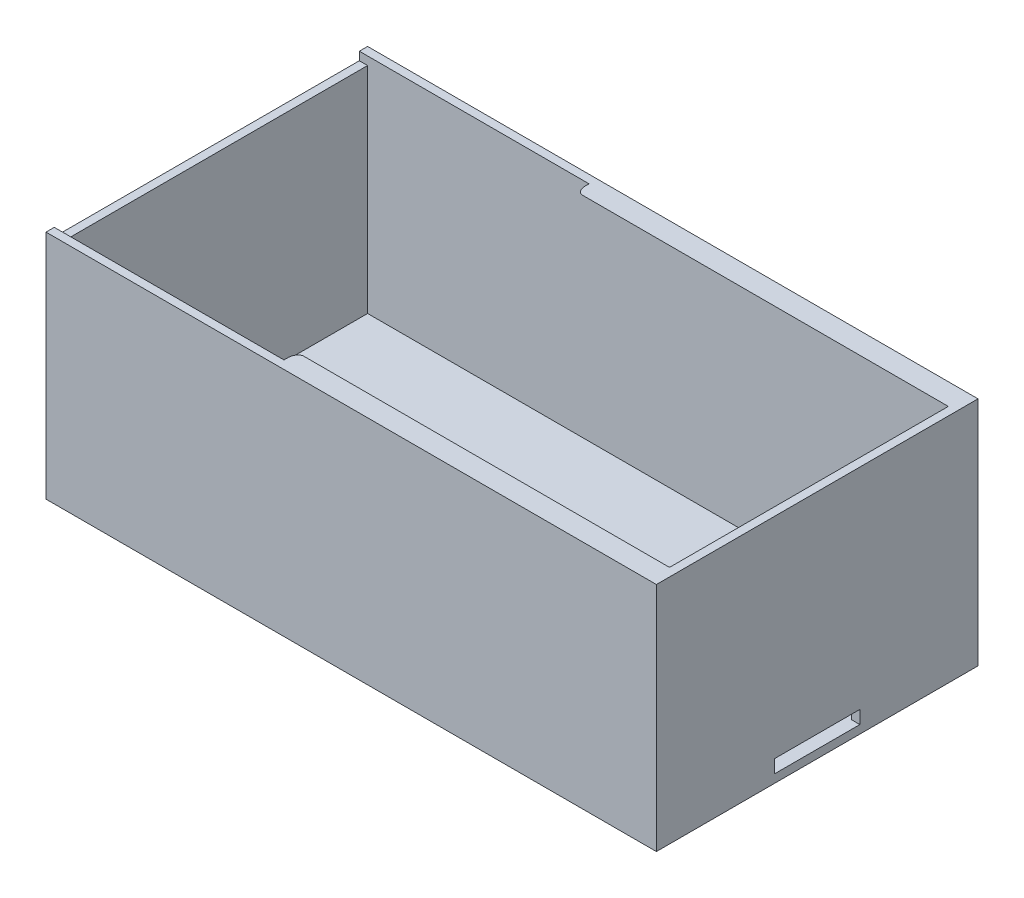
from build123d import *

# Parameters (mm, degrees)
ESBO_O1_W                = 93
ESBO_O1_H                = 49
RESSALTO_EXTRUS_O1_DEPTH = 1.26
ESBO_O2_W                = 93
ESBO_O2_H                = 1.26
RESSALTO_EXTRUS_O2_DEPTH = 35.24
ESBO_O3_W                = 1.26
ESBO_O3_H                = 49
RESSALTO_EXTRUS_O4_DEPTH = 35.24
RESSALTO_EXTRUS_O5_START = 35
RESSALTO_EXTRUS_O5_DEPTH = 57
FILETE1_R                = 1
FILETE2_R                = 1
ESBO_O6_W                = 1.26
ESBO_O6_H                = 49
RESSALTO_EXTRUS_O6_DEPTH = 33.98
ESBO_O7_W                = 11
ESBO_O7_H                = 2
CORTE_EXTRUS_O1_DEPTH    = 1.26
ESBO_O8_W                = 13
ESBO_O8_H                = 2
CORTE_EXTRUS_O2_DEPTH    = 1.26
RESSALTO_EXTRUS_O7_DEPTH = 2
RESSALTO_EXTRUS_O8_DEPTH = 2


with BuildPart() as part:
    # Esboço1 → Ressalto-extrusão1 (new body)
    with BuildSketch(Plane(origin=(0, 0, 0), x_dir=(1, 0, 0), z_dir=(0, 1, 0))):
        with Locations((46.5, -24.5)):
            Rectangle(ESBO_O1_W, ESBO_O1_H)
    extrude(amount=RESSALTO_EXTRUS_O1_DEPTH)

    # Esboço2 → Ressalto-extrusão2 (add)
    with BuildSketch(Plane(origin=(0, 0, 0), x_dir=(1, 0, 0), z_dir=(0, 1, 0))):
        with Locations((46.5, -0.63)):
            Rectangle(ESBO_O2_W, ESBO_O2_H)
        with Locations((46.5, -48.37)):
            Rectangle(ESBO_O2_W, ESBO_O2_H)
    extrude(amount=RESSALTO_EXTRUS_O2_DEPTH)

    # Esboço3 → Ressalto-extrusão4 (add)
    with BuildSketch(Plane(origin=(0, 0, 0), x_dir=(1, 0, 0), z_dir=(0, 1, 0))):
        with Locations((92.37, -24.5)):
            Rectangle(ESBO_O3_W, ESBO_O3_H)
    extrude(amount=RESSALTO_EXTRUS_O4_DEPTH)

    # Esboço5 → Ressalto-extrusão5 (add)
    with BuildSketch(Plane(origin=(0, 0, 0), x_dir=(0, 0, -1), z_dir=(1, 0, 0)).offset(RESSALTO_EXTRUS_O5_START)):
        Polygon((0, 35.24), (-3.26, 35.24), (0, 31.98), align=None)
        Polygon((-49, 35.24), (-45.74, 35.24), (-49, 31.98), align=None)
    extrude(amount=RESSALTO_EXTRUS_O5_DEPTH)

    # Filete1
    filete1_edges = [part.edges().sort_by_distance(p)[0] for p in [
        (35, 34.24, 46.74),
    ]]
    fillet(filete1_edges, radius=FILETE1_R)

    # Filete2
    filete2_edges = [part.edges().sort_by_distance(p)[0] for p in [
        (35, 34.24, 2.26),
    ]]
    fillet(filete2_edges, radius=FILETE2_R)

    # Esboço6 → Ressalto-extrusão6 (add)
    with BuildSketch(Plane(origin=(0, 0, 0), x_dir=(1, 0, 0), z_dir=(0, 1, 0))):
        with Locations((0.63, -24.5)):
            Rectangle(ESBO_O6_W, ESBO_O6_H)
    extrude(amount=RESSALTO_EXTRUS_O6_DEPTH)

    # Esboço7 → Corte-extrusão1 (cut)
    with BuildSketch(Plane.ZY):
        with Locations((24.5, 2.26)):
            Rectangle(ESBO_O7_W, ESBO_O7_H)
    extrude(amount=-CORTE_EXTRUS_O1_DEPTH, mode=Mode.SUBTRACT)

    # Esboço8 → Corte-extrusão2 (cut)
    with BuildSketch(Plane(origin=(93, 0, 0), x_dir=(0, 0, -1), z_dir=(1, 0, 0))):
        with Locations((-24.5, 2.26)):
            Rectangle(ESBO_O8_W, ESBO_O8_H)
    extrude(amount=-CORTE_EXTRUS_O2_DEPTH, mode=Mode.SUBTRACT)

    # Esboço10 → Ressalto-extrusão7 (add)
    with BuildSketch(Plane(origin=(0, 1.26, 0), x_dir=(1, 0, 0), z_dir=(0, 1, 0))):
        Polygon((4, -15.74), (4, -17), (8, -17), (8, -19), (9.26, -19), (9.26, -15.74), align=None)
        Polygon((4, -32), (4, -33.26), (9.26, -33.26), (9.26, -30), (8, -30), (8, -32), align=None)
    extrude(amount=RESSALTO_EXTRUS_O7_DEPTH)

    # Esboço11 → Ressalto-extrusão8 (add)
    with BuildSketch(Plane(origin=(0, 1.26, 0), x_dir=(1, 0, 0), z_dir=(0, 1, 0))):
        Polygon((87.74, -14.24), (83.74, -14.24), (83.74, -17.5), (85, -17.5), (85, -15.5), (87.74, -15.5), align=None)
        Polygon((87.74, -33.5), (87.74, -34.76), (83.74, -34.76), (83.74, -31.5), (85, -31.5), (85, -33.5), align=None)
    extrude(amount=RESSALTO_EXTRUS_O8_DEPTH)


solid = part.part
